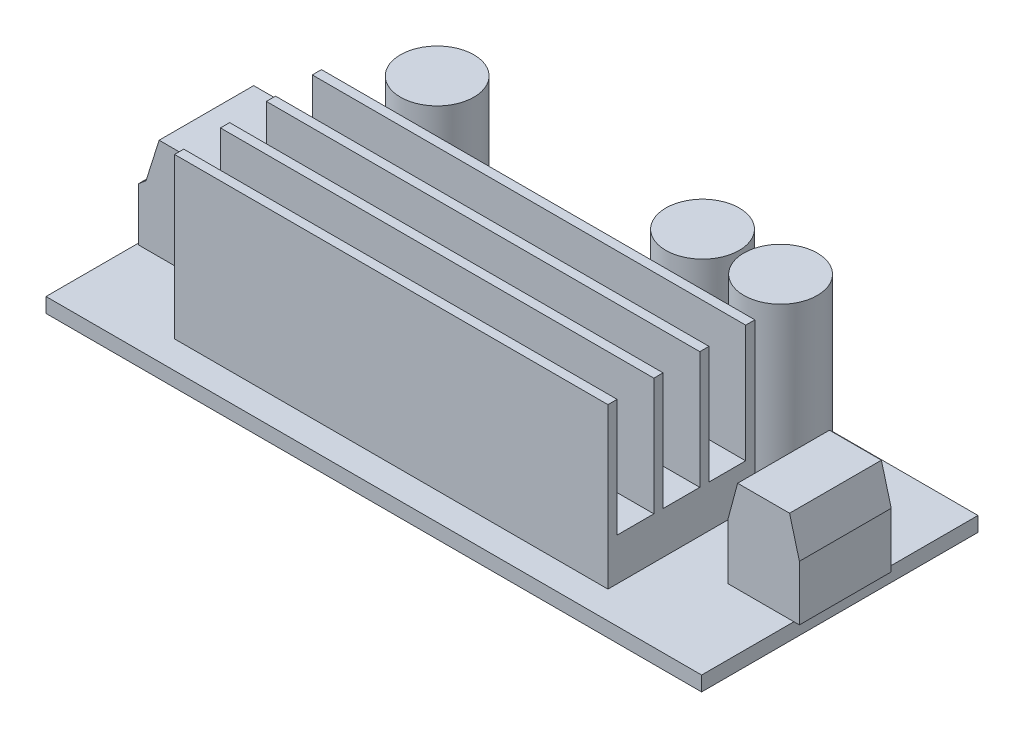
from build123d import *
from OCP.BRepFilletAPI import BRepFilletAPI_MakeChamfer

# Parameters (mm, degrees)
SKETCH1_W           = 71.4
SKETCH1_H           = 30.1
BOSS_EXTRUDE1_DEPTH = 1.6
SKETCH4_W           = 47.2
SKETCH4_H           = 16
BOSS_EXTRUDE2_DEPTH = 17.4
SKETCH5_W           = 10.3
SKETCH5_H           = 10.3
BOSS_EXTRUDE3_DEPTH = 11
SKETCH6_W           = 7.8
SKETCH6_H           = 10
BOSS_EXTRUDE4_DEPTH = 10
SKETCH7_R           = 4
BOSS_EXTRUDE5_DEPTH = 16.5
SKETCH8_W           = 4
SKETCH8_H           = 12.8
CUT_EXTRUDE1_DEPTH  = 47.2
CUT_EXTRUDE2_DEPTH  = 10.3
CHAMFER1_SIZE       = 4
CHAMFER1_SIZE2      = 1.07179677


with BuildPart() as part:
    # Sketch1 → Boss-Extrude1 (new body)
    with BuildSketch(Plane(origin=(0, 0, 0), x_dir=(1, 0, 0), z_dir=(0, 1, 0))):
        Rectangle(SKETCH1_W, SKETCH1_H)
    extrude(amount=BOSS_EXTRUDE1_DEPTH)

    # Sketch4 → Boss-Extrude2 (add)
    with BuildSketch(Plane(origin=(0, 1.6, 0), x_dir=(1, 0, 0), z_dir=(0, 1, 0))):
        with Locations((-1.1, -4.05)):
            Rectangle(SKETCH4_W, SKETCH4_H)
    extrude(amount=BOSS_EXTRUDE2_DEPTH)

    # Sketch5 → Boss-Extrude3 (add)
    with BuildSketch(Plane(origin=(0, 1.6, 0), x_dir=(1, 0, 0), z_dir=(0, 1, 0))):
        with Locations((-30.35, 0)):
            Rectangle(SKETCH5_W, SKETCH5_H)
    extrude(amount=BOSS_EXTRUDE3_DEPTH)

    # Sketch6 → Boss-Extrude4 (add)
    with BuildSketch(Plane(origin=(0, 1.6, 0), x_dir=(1, 0, 0), z_dir=(0, 1, 0))):
        with Locations((32.4, 0)):
            Rectangle(SKETCH6_W, SKETCH6_H)
    extrude(amount=BOSS_EXTRUDE4_DEPTH)

    # Sketch7 → Boss-Extrude5 (add)
    with BuildSketch(Plane(origin=(0, 1.6, 0), x_dir=(1, 0, 0), z_dir=(0, 1, 0))):
        with Locations(Location((18.7, 10.55, 0), (0, 0, 90))):
            Circle(SKETCH7_R)
        with Locations(Location((10.2, 10.55, 0), (0, 0, 90))):
            Circle(SKETCH7_R)
        with Locations(Location((-18.7, 10.55, 0), (0, 0, 90))):
            Circle(SKETCH7_R)
    extrude(amount=BOSS_EXTRUDE5_DEPTH)

    # Sketch8 → Cut-Extrude1 (cut)
    with BuildSketch(Plane.ZY.offset(24.7)):
        with Locations((-0.95, 12.6)):
            Rectangle(SKETCH8_W, SKETCH8_H)
        with Locations((4.05, 12.6)):
            Rectangle(SKETCH8_W, SKETCH8_H)
        with Locations((9.05, 12.6)):
            Rectangle(SKETCH8_W, SKETCH8_H)
    extrude(amount=-CUT_EXTRUDE1_DEPTH, mode=Mode.SUBTRACT)

    # Sketch9 → Cut-Extrude2 (cut)
    with BuildSketch(Plane.XY.offset(5.15)):
        Polygon((-35.5, 12.6), (-35.5, 7.401794315), (-34.710010842, 8.059862443), (-33.280204433, 12.6), align=None)
        Polygon((-25.2, 12.6), (-26.836436424, 12.6), (-25.2, 6.114977788), align=None)
    extrude(amount=-CUT_EXTRUDE2_DEPTH, mode=Mode.SUBTRACT)

    # Chamfer1: one chamfer whose edges measure the first distance from different faces: ONE call of the kernel's chamfer builder (chamfer() names one face for all edges)
    chamfer1_edges_1 = [part.edges().sort_by_distance(p)[0] for p in [
        (36.3, 11.6, 0),
    ]]
    chamfer1_side_1 = [part.faces().sort_by_distance(p)[0] for p in [
        (36.3, 6.6, 0),
    ]]
    chamfer1_edges_2 = [part.edges().sort_by_distance(p)[0] for p in [
        (28.5, 11.6, 0),
    ]]
    chamfer1_side_2 = [part.faces().sort_by_distance(p)[0] for p in [
        (28.5, 6.6, 0),
    ]]
    chamfer1 = BRepFilletAPI_MakeChamfer(part.part.solid().wrapped)
    for e in chamfer1_edges_1:
        chamfer1.Add(CHAMFER1_SIZE, CHAMFER1_SIZE2, e.wrapped, chamfer1_side_1[0].wrapped)  # the first distance lies on this face
    for e in chamfer1_edges_2:
        chamfer1.Add(CHAMFER1_SIZE, CHAMFER1_SIZE2, e.wrapped, chamfer1_side_2[0].wrapped)  # the first distance lies on this face
    add(Compound.cast(chamfer1.Shape()), mode=Mode.REPLACE)


solid = part.part
